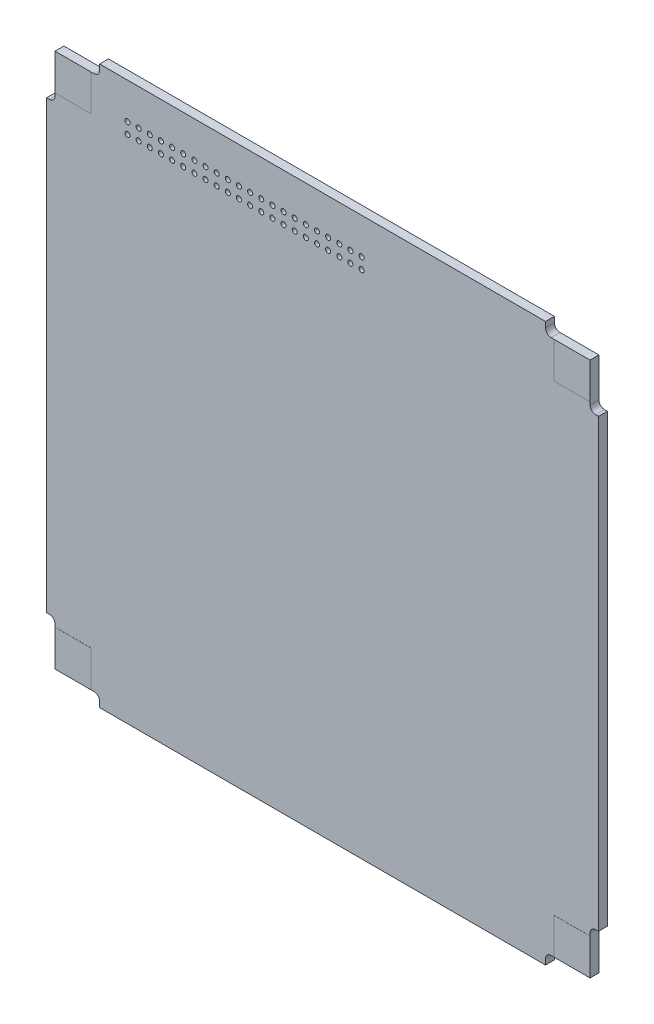
from build123d import *

# Parameters (mm, degrees)
BOSS_EXTRUDE1_DEPTH = 1.5875
FILLET1_R           = 1
SKETCH2_R           = 0.45
CUT_EXTRUDE1_DEPTH  = 71.728496069
SKETCH4_W           = 6.5
SKETCH4_H           = 6.5
BOSS_EXTRUDE2_DEPTH = 0.01
SKETCH5_OUTSIDE_W   = 130.286
SKETCH5_OUTSIDE_H   = 130.286
SKETCH5_OUTSIDE_W_2 = 99
SKETCH5_OUTSIDE_H_2 = 100
CUT_EXTRUDE3_DEPTH  = 71.728721226


with BuildPart() as part:
    # Sketch1 → Boss-Extrude1 (new body)
    with BuildSketch(Plane.XY):
        Polygon((40, 50), (-40, 50), (-40, 48), (-48, 48), (-48, 40), (-50, 40), (-50, -37.864895224), (-50, -40), (-48, -40), (-48, -48), (-40, -48), (-40, -50), (-37.864895224, -50), (40, -50), (40, -48), (48, -48), (48, -40), (50, -40), (50, 40), (48, 40), (48, 48), (40, 48), align=None)
    extrude(amount=BOSS_EXTRUDE1_DEPTH)

    # Fillet1
    fillet1_edges = [part.edges().sort_by_distance(p)[0] for p in [
        (-48, -40, 0.79375),
        (-48, 40, 0.79375),
        (-40, 48, 0.79375),
        (40, 48, 0.79375),
        (48, 40, 0.79375),
        (48, -40, 0.79375),
        (40, -48, 0.79375),
        (-40, -48, 0.79375),
    ]]
    fillet(fillet1_edges, radius=FILLET1_R)

    # Sketch2 → Cut-Extrude1 (cut, through all)
    with BuildSketch(Plane.XY.offset(1.5875)):
        with Locations((-35, 43.55)):
            Circle(SKETCH2_R)
        with Locations((-33, 43.55)):
            Circle(SKETCH2_R)
        with Locations((-31, 43.55)):
            Circle(SKETCH2_R)
        with Locations((-29, 43.55)):
            Circle(SKETCH2_R)
        with Locations((-27, 43.55)):
            Circle(SKETCH2_R)
        with Locations((-25, 43.55)):
            Circle(SKETCH2_R)
        with Locations((-23, 43.55)):
            Circle(SKETCH2_R)
        with Locations((-21, 43.55)):
            Circle(SKETCH2_R)
        with Locations((-19, 43.55)):
            Circle(SKETCH2_R)
        with Locations((-17, 43.55)):
            Circle(SKETCH2_R)
        with Locations((-15, 43.55)):
            Circle(SKETCH2_R)
        with Locations((-13, 43.55)):
            Circle(SKETCH2_R)
        with Locations((-11, 43.55)):
            Circle(SKETCH2_R)
        with Locations((-9, 43.55)):
            Circle(SKETCH2_R)
        with Locations((-7, 43.55)):
            Circle(SKETCH2_R)
        with Locations((-5, 43.55)):
            Circle(SKETCH2_R)
        with Locations((-3, 43.55)):
            Circle(SKETCH2_R)
        with Locations((-1, 43.55)):
            Circle(SKETCH2_R)
        with Locations((1, 43.55)):
            Circle(SKETCH2_R)
        with Locations((3, 43.55)):
            Circle(SKETCH2_R)
        with Locations((5, 43.55)):
            Circle(SKETCH2_R)
        with Locations((7, 43.55)):
            Circle(SKETCH2_R)
        with Locations((-33, 41.55)):
            Circle(SKETCH2_R)
        with Locations((-31, 41.55)):
            Circle(SKETCH2_R)
        with Locations((-29, 41.55)):
            Circle(SKETCH2_R)
        with Locations((-27, 41.55)):
            Circle(SKETCH2_R)
        with Locations((-25, 41.55)):
            Circle(SKETCH2_R)
        with Locations((-23, 41.55)):
            Circle(SKETCH2_R)
        with Locations((-21, 41.55)):
            Circle(SKETCH2_R)
        with Locations((-19, 41.55)):
            Circle(SKETCH2_R)
        with Locations((-17, 41.55)):
            Circle(SKETCH2_R)
        with Locations((-15, 41.55)):
            Circle(SKETCH2_R)
        with Locations((-13, 41.55)):
            Circle(SKETCH2_R)
        with Locations((-11, 41.55)):
            Circle(SKETCH2_R)
        with Locations((-9, 41.55)):
            Circle(SKETCH2_R)
        with Locations((-7, 41.55)):
            Circle(SKETCH2_R)
        with Locations((-5, 41.55)):
            Circle(SKETCH2_R)
        with Locations((-3, 41.55)):
            Circle(SKETCH2_R)
        with Locations((-1, 41.55)):
            Circle(SKETCH2_R)
        with Locations((1, 41.55)):
            Circle(SKETCH2_R)
        with Locations((3, 41.55)):
            Circle(SKETCH2_R)
        with Locations((5, 41.55)):
            Circle(SKETCH2_R)
        with Locations((7, 41.55)):
            Circle(SKETCH2_R)
        with Locations((-35, 41.55)):
            Circle(SKETCH2_R)
    extrude(amount=-CUT_EXTRUDE1_DEPTH, mode=Mode.SUBTRACT)

    # Sketch4 → Boss-Extrude2 (add)
    with BuildSketch(Plane.XY.offset(1.5875)):
        with Locations((-44.75, 44.75)):
            Rectangle(SKETCH4_W, SKETCH4_H)
        with Locations((-44.75, -44.75)):
            Rectangle(SKETCH4_W, SKETCH4_H)
        with Locations((44.75, -44.75)):
            Rectangle(SKETCH4_W, SKETCH4_H)
        with Locations((44.75, 44.75)):
            Rectangle(SKETCH4_W, SKETCH4_H)
    extrude(amount=BOSS_EXTRUDE2_DEPTH)

    # Sketch5 outside → Cut-Extrude3 (cut, through all)
    with BuildSketch(Plane(origin=(0, 0, 0), x_dir=(-1, 0, 0), z_dir=(0, 0, -1))):
        Rectangle(SKETCH5_OUTSIDE_W, SKETCH5_OUTSIDE_H)
        Rectangle(SKETCH5_OUTSIDE_W_2, SKETCH5_OUTSIDE_H_2, mode=Mode.SUBTRACT)
    extrude(amount=-CUT_EXTRUDE3_DEPTH, mode=Mode.SUBTRACT)


solid = part.part
